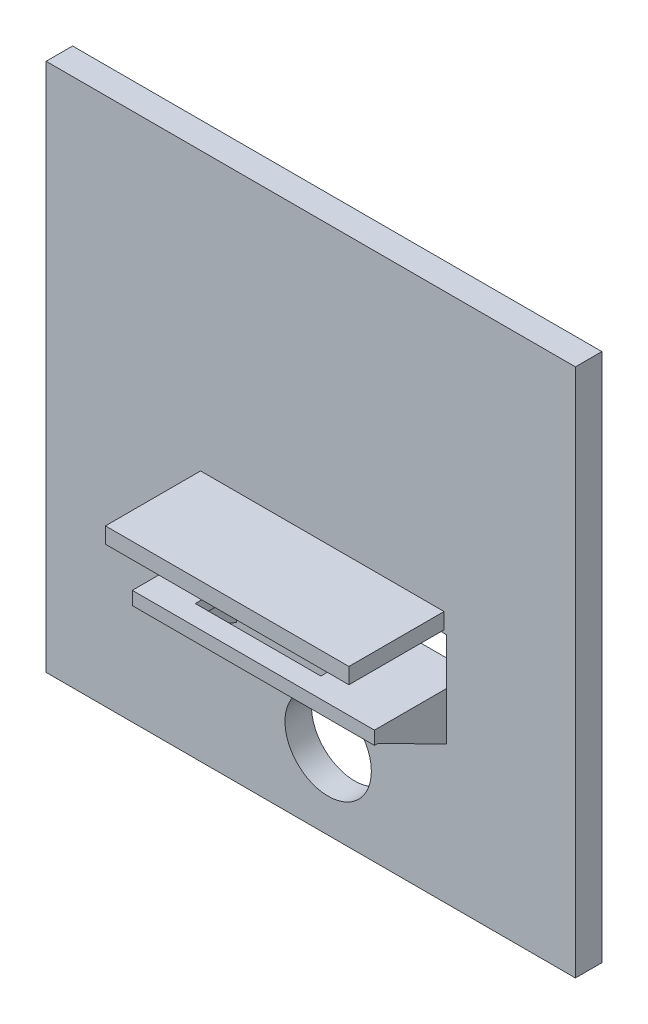
from build123d import *

# Parameters (mm, degrees)
SKETCH1_W            = 200
SKETCH1_H            = 200
SKETCH1_R            = 16.317818037
SKETCH1_W_2          = 91.5
SKETCH1_H_2          = 17.6
BOSS_EXTRUDE1_DEPTH  = 10
SKETCH2_W            = 91.5
SKETCH2_H            = 27.244287947
SKETCH2_W_2          = 47.464374426
SKETCH2_H_2          = 14.833412225
BOSS_EXTRUDE2_DEPTH  = 5
BOSS_EXTRUDE3_DEPTH  = 12.038189492
BOSS_EXTRUDE4_DEPTH  = 12
SKETCH8_W            = 92.000196745
SKETCH8_H            = 35.96348769
BOSS_EXTRUDE10_DEPTH = 6


with BuildPart() as part:
    # Sketch1 → Boss-Extrude1 (new body)
    with BuildSketch(Plane.XY):
        with Locations((100, -23.762376238)):
            Rectangle(SKETCH1_W, SKETCH1_H)
        with Locations((106.569920284, -94.672205515)):
            Circle(SKETCH1_R, mode=Mode.SUBTRACT)
        with Locations((105.557336771, -44.56947193)):
            Rectangle(SKETCH1_W_2, SKETCH1_H_2, mode=Mode.SUBTRACT)
    extrude(amount=BOSS_EXTRUDE1_DEPTH)

    # Sketch2 → Boss-Extrude2 (add)
    with BuildSketch(Plane.XZ.offset(53.36947193)):
        with Locations((105.557336771, 23.622143974)):
            Rectangle(SKETCH2_W, SKETCH2_H)
        with Locations((99.758455932, 22.261354849)):
            Rectangle(SKETCH2_W_2, SKETCH2_H_2, mode=Mode.SUBTRACT)
    extrude(amount=BOSS_EXTRUDE2_DEPTH)

    # Sketch5 → Boss-Extrude3 (add)
    with BuildSketch(Plane.ZY.offset(-59.807336771)):
        Polygon((37.244287947, -58.36947193), (10, -71.570582827), (10, -58.36947193), align=None)
    extrude(amount=-BOSS_EXTRUDE3_DEPTH)

    # Sketch6 → Boss-Extrude4 (add)
    with BuildSketch(Plane(origin=(151.307336771, 0, 0), x_dir=(0, 0, -1), z_dir=(1, 0, 0))):
        Polygon((-37.244287947, -57.677457741), (-10, -71.570582827), (-10, -58.36947193), align=None)
    extrude(amount=-BOSS_EXTRUDE4_DEPTH)


with BuildPart() as body_2:
    # Sketch8 → Boss-Extrude10 (new body)
    with BuildSketch(Plane(origin=(0, -33.36947193, 0), x_dir=(1, 0, 0), z_dir=(0, 1, 0))):
        with Locations((105.640351876, -29.251136539)):
            Rectangle(SKETCH8_W, SKETCH8_H)
    extrude(amount=BOSS_EXTRUDE10_DEPTH)


solid = Compound([part.part, body_2.part])
